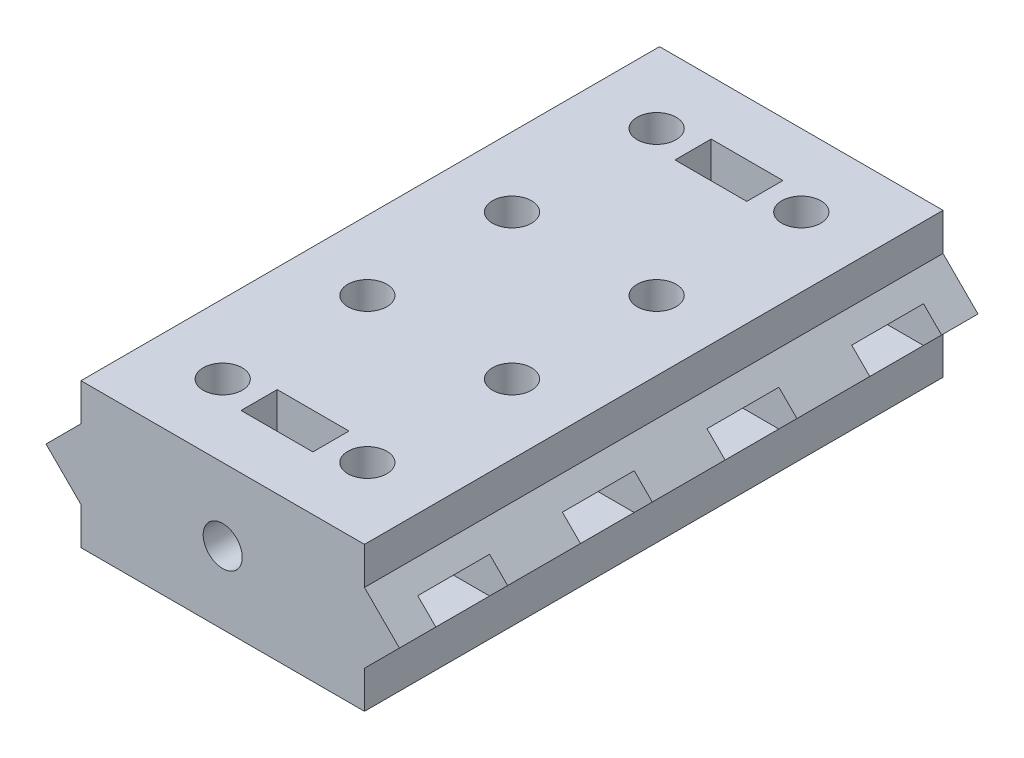
from build123d import *

# Parameters (mm, degrees)
BOSS_EXTRUDE1_DEPTH = 50.8
CUT_EXTRUDE1_DEPTH  = 3.175
SKETCH3_R           = 3.429
CUT_EXTRUDE2_DEPTH  = 66.068137364
SKETCH5_R           = 3.429
CUT_EXTRUDE4_DEPTH  = 108.200338152
CUT_EXTRUDE9_START  = 38.1
CUT_EXTRUDE9_DEPTH  = 3.175
SKETCH11_OUTSIDE_W  = 89.994
SKETCH11_OUTSIDE_H  = 51.894
TRIM_DEPTH          = 108.200338152


with BuildPart() as part:
    # Sketch1 → Boss-Extrude1 (new, symmetric)
    with BuildSketch(Plane.XY):
        Polygon((-25.4, 6.35), (-25.4, 12.7), (25.4, 12.7), (25.4, 6.35), (31.75, 0), (25.4, -6.35), (25.4, -12.7), (-25.4, -12.7), (-25.4, -6.35), (-31.75, 0), align=None)
    extrude(amount=BOSS_EXTRUDE1_DEPTH, both=True)

    # Sketch2 → Cut-Extrude1 (cut, symmetric)
    with BuildSketch(Plane(origin=(0, 0, 0), x_dir=(1, 0, 0), z_dir=(0, 1, 0))):
        Polygon((48.874015971, 6.39418036), (12.7, 6.39418036), (7.239, 9.54709018), (7.239, 15.85290982), (12.7, 19.00581964), (48.874015971, 19.00581964), align=None)
        Polygon((48.874015971, -19.00581964), (12.7, -19.00581964), (7.239, -15.85290982), (7.239, -9.54709018), (12.7, -6.39418036), (48.874015971, -6.39418036), align=None)
        Polygon((7.239, 34.94709018), (12.7, 31.79418036), (48.874015971, 31.79418036), (48.874015971, 44.40581964), (12.7, 44.40581964), (7.239, 41.25290982), align=None)
        Polygon((48.874015971, -44.40581964), (12.7, -44.40581964), (7.239, -41.25290982), (7.239, -34.94709018), (12.7, -31.79418036), (48.874015971, -31.79418036), align=None)
        Polygon((-7.239, -34.94709018), (-7.239, -41.25290982), (-12.7, -44.40581964), (-48.874015971, -44.40581964), (-48.874015971, -31.79418036), (-12.7, -31.79418036), align=None)
        Polygon((-48.874015971, -6.39418036), (-48.874015971, -19.00581964), (-12.7, -19.00581964), (-7.239, -15.85290982), (-7.239, -9.54709018), (-12.7, -6.39418036), align=None)
        Polygon((-48.874015971, 31.79418036), (-12.7, 31.79418036), (-7.239, 34.94709018), (-7.239, 41.25290982), (-12.7, 44.40581964), (-48.874015971, 44.40581964), align=None)
        Polygon((-48.874015971, 19.00581964), (-48.874015971, 6.39418036), (-12.7, 6.39418036), (-7.239, 9.54709018), (-7.239, 15.85290982), (-12.7, 19.00581964), align=None)
    extrude(amount=CUT_EXTRUDE1_DEPTH, both=True, mode=Mode.SUBTRACT)

    # Sketch3 → Cut-Extrude2 (cut, through all)
    with BuildSketch(Plane(origin=(0, 12.7, 0), x_dir=(1, 0, 0), z_dir=(0, 1, 0))):
        with Locations(Location((-12.7, 38.1, 0), (0, 0, 180))):
            Circle(SKETCH3_R)
        with Locations(Location((12.7, 38.1, 0), (0, 0, 180))):
            Circle(SKETCH3_R)
        with Locations(Location((12.7, 12.7, 0), (0, 0, 180))):
            Circle(SKETCH3_R)
        with Locations(Location((-12.7, 12.7, 0), (0, 0, 180))):
            Circle(SKETCH3_R)
        with Locations(Location((-12.7, -12.7, 0), (0, 0, 180))):
            Circle(SKETCH3_R)
        with Locations(Location((12.7, -12.7, 0), (0, 0, 180))):
            Circle(SKETCH3_R)
        with Locations(Location((-12.7, -38.1, 0), (0, 0, 180))):
            Circle(SKETCH3_R)
        with Locations(Location((12.7, -38.1, 0), (0, 0, 180))):
            Circle(SKETCH3_R)
    extrude(amount=-CUT_EXTRUDE2_DEPTH, mode=Mode.SUBTRACT)

    # Sketch5 → Cut-Extrude4 (cut, through all)
    with BuildSketch(Plane.XY.offset(50.8)):
        Circle(SKETCH5_R)
    extrude(amount=-CUT_EXTRUDE4_DEPTH, mode=Mode.SUBTRACT)

    # Sketch10 → Cut-Extrude9 (cut, symmetric)
    with BuildSketch(Plane.XY.offset(CUT_EXTRUDE9_START)):
        Polygon((3.15290982, -5.461), (6.30581964, 0), (6.30581964, 55.166180444), (-6.30581964, 55.166180444), (-6.30581964, 0), (-3.15290982, -5.461), align=None)
    cut_extrude9 = extrude(amount=CUT_EXTRUDE9_DEPTH, both=True, mode=Mode.SUBTRACT)

    # Mirror1: Cut-Extrude9 across plane
    add(cut_extrude9.mirror(Plane.XY), mode=Mode.SUBTRACT)

    # Sketch11 outside → Trim (cut, through all)
    with BuildSketch(Plane.XY.offset(50.8)):
        Rectangle(SKETCH11_OUTSIDE_W, SKETCH11_OUTSIDE_H)
        Polygon((-24.892, 12.7), (-24.892, 6.13957951), (-31.03157951, 0), (-24.892, -6.13957951), (-24.892, -12.7), (24.892, -12.7), (24.892, -6.13957951), (31.03157951, 0), (24.892, 6.13957951), (24.892, 12.7), align=None, mode=Mode.SUBTRACT)
    extrude(amount=-TRIM_DEPTH, mode=Mode.SUBTRACT)


solid = part.part
